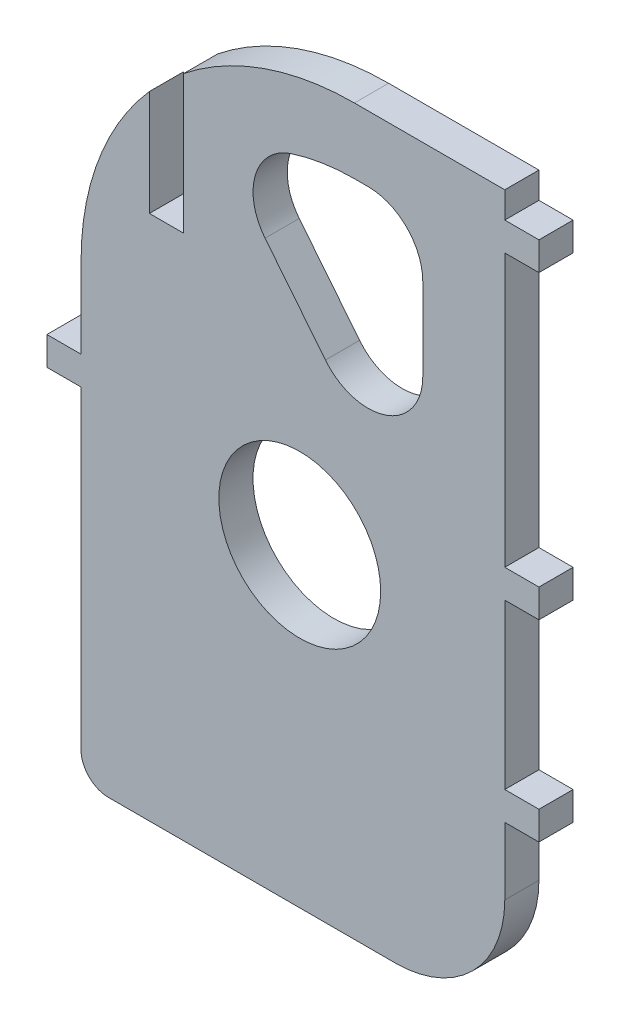
from build123d import *

# Parameters (mm, degrees)
SKETCH1_R              = 3.7592
BOSS_EXTRUDE1_DEPTH    = 1.5875
FILLET1_R              = 5.08
FILLET2_R              = 1.27
SKETCH3_W              = 1.5875
SKETCH3_H              = 9.2075
CUT_EXTRUDE1_DEPTH     = 23.437165875
WEIGHT_REDUCTION_REACH = 24.437
FILLET3_R              = 2.54


with BuildPart() as part:
    # Sketch1 → Boss-Extrude1 (new body)
    with BuildSketch(Plane.XY):
        with BuildLine():
            Line((11.1125, 17.8308), (9.525, 17.8308))
            Line((9.525, 17.8308), (9.525, 19.05))
            Line((9.525, 19.05), (2.54, 19.05))
            ThreePointArc((2.54, 19.05), (-6.440256121, 15.330256121), (-10.16, 6.35))
            Line((-10.16, 6.35), (-10.16, 2.5908))
            Line((-10.16, 2.5908), (-11.7475, 2.5908))
            Line((-11.7475, 2.5908), (-11.7475, 1.27))
            Line((-11.7475, 1.27), (-10.16, 1.27))
            Line((-10.16, 1.27), (-10.16, -14.605))
            Line((-10.16, -14.605), (9.525, -14.605))
            Line((9.525, -14.605), (9.525, -6.4008))
            Line((9.525, -6.4008), (11.1125, -6.4008))
            Line((11.1125, -6.4008), (11.1125, -5.08))
            Line((11.1125, -5.08), (9.525, -5.08))
            Line((9.525, -5.08), (9.525, 2.54))
            Line((9.525, 2.54), (11.1125, 2.54))
            Line((11.1125, 2.54), (11.1125, 3.8608))
            Line((11.1125, 3.8608), (9.525, 3.8608))
            Line((9.525, 3.8608), (9.525, 16.51))
            Line((9.525, 16.51), (11.1125, 16.51))
            Line((11.1125, 16.51), (11.1125, 17.8308))
        make_face()
        Circle(SKETCH1_R, mode=Mode.SUBTRACT)
    extrude(amount=BOSS_EXTRUDE1_DEPTH)

    # Fillet1
    fillet1_edges = [part.edges().sort_by_distance(p)[0] for p in [
        (9.525, -14.605, 0.79375),
    ]]
    fillet(fillet1_edges, radius=FILLET1_R)

    # Fillet2
    fillet2_edges = [part.edges().sort_by_distance(p)[0] for p in [
        (-10.16, -14.605, 0.79375),
    ]]
    fillet(fillet2_edges, radius=FILLET2_R)

    # Sketch3 → Cut-Extrude1 (cut, through all)
    with BuildSketch(Plane(origin=(0, 0, 0), x_dir=(-1, 0, 0), z_dir=(0, 0, -1))):
        with Locations((6.19125, 14.44625)):
            Rectangle(SKETCH3_W, SKETCH3_H)
    extrude(amount=-CUT_EXTRUDE1_DEPTH, mode=Mode.SUBTRACT)

    # Sketch2 → Weight Reduction (cut, up to next)
    with BuildSketch(Plane.XY.offset(1.5875), mode=Mode.PRIVATE) as weight_reduction_sk1:
        with BuildLine():
            Line((-3.4925, 13.884590085), (5.715, 2.384426271))
            Line((5.715, 2.384426271), (5.715, 16.002))
            Line((5.715, 16.002), (2.54, 16.002))
            ThreePointArc((2.54, 16.002), (-0.656657668, 15.457276418), (-3.4925, 13.884590085))
        make_face()
    weight_reduction_tool1 = extrude(weight_reduction_sk1.sketch, amount=-WEIGHT_REDUCTION_REACH, mode=Mode.PRIVATE) & part.part
    add(weight_reduction_tool1.solids().sort_by_distance((2.48474, 11.130093, 1.5875))[0], mode=Mode.SUBTRACT)

    # Fillet3
    fillet3_edges = [part.edges().sort_by_distance(p)[0] for p in [
        (5.715, 16.002, 0.79375),
        (5.715, 2.384426271, 0.79375),
        (-3.4925, 13.884590085, 0.79375),
    ]]
    fillet(fillet3_edges, radius=FILLET3_R)


solid = part.part
